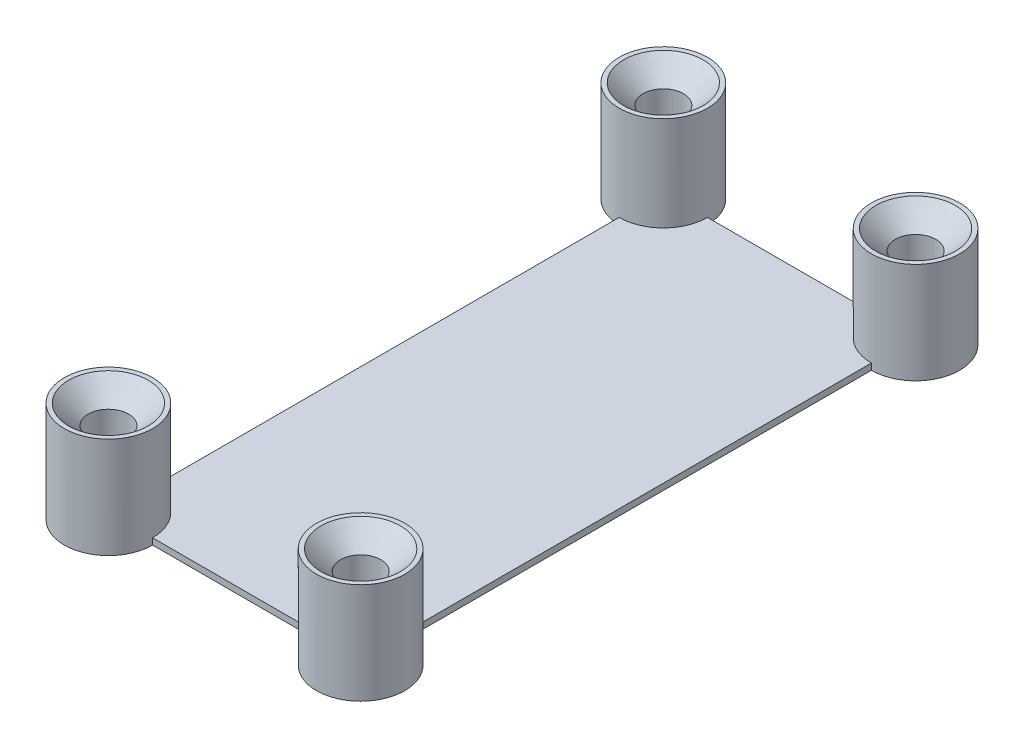
from build123d import *

# Parameters (mm, degrees)
SKETCH2_W                                       = 20
SKETCH2_H                                       = 44
BOSS_EXTRUDE2_DEPTH                             = 0.5
SKETCH4_R                                       = 3.5
BOSS_EXTRUDE3_DEPTH                             = 8
CSK_FOR_M3_FLAT_HEAD_MACHINE_SCREW1_D           = 3.2
CSK_FOR_M3_FLAT_HEAD_MACHINE_SCREW1_DEPTH       = 13.03862301
CSK_FOR_M3_FLAT_HEAD_MACHINE_SCREW1_CSINK_D     = 6.3
CSK_FOR_M3_FLAT_HEAD_MACHINE_SCREW1_CSINK_ANGLE = 90
CSK_FOR_M3_FLAT_HEAD_MACHINE_SCREW1_TIP         = 0.96137699


with BuildPart() as part:
    # Sketch2 → Boss-Extrude2 (new body)
    with BuildSketch(Plane(origin=(0, 0, 0), x_dir=(1, 0, 0), z_dir=(0, 1, 0))):
        with Locations((10, 22)):
            Rectangle(SKETCH2_W, SKETCH2_H)
    extrude(amount=BOSS_EXTRUDE2_DEPTH)

    # Sketch4 → Boss-Extrude3 (add)
    with BuildSketch(Plane(origin=(0, 0, 0), x_dir=(1, 0, 0), z_dir=(0, 1, 0))):
        with Locations(Location((20, 44, 0), (0, 0, 270))):
            Circle(SKETCH4_R)
        with Locations(Location((0, 44, 0), (0, 0, 90))):
            Circle(SKETCH4_R)
        with Locations(Location((20, 0, 0), (0, 0, 90))):
            Circle(SKETCH4_R)
        with Locations(Location((0, 0, 0), (0, 0, 90))):
            Circle(SKETCH4_R)
    extrude(amount=BOSS_EXTRUDE3_DEPTH)

    # CSK for M3 Flat Head Machine Screw1
    with Locations(Plane(origin=(0, 8, 0), x_dir=(1, 0, 0), z_dir=(0, 1, 0))):
        with Locations((20, 44), (0, 44), (0, 0), (20, 0)):
            CounterSinkHole(CSK_FOR_M3_FLAT_HEAD_MACHINE_SCREW1_D / 2, CSK_FOR_M3_FLAT_HEAD_MACHINE_SCREW1_CSINK_D / 2, depth=CSK_FOR_M3_FLAT_HEAD_MACHINE_SCREW1_DEPTH, counter_sink_angle=CSK_FOR_M3_FLAT_HEAD_MACHINE_SCREW1_CSINK_ANGLE)
            with Locations((0, 0, -(CSK_FOR_M3_FLAT_HEAD_MACHINE_SCREW1_DEPTH + CSK_FOR_M3_FLAT_HEAD_MACHINE_SCREW1_TIP / 2))):  # 118° drill point
                Cone(0, CSK_FOR_M3_FLAT_HEAD_MACHINE_SCREW1_D / 2, CSK_FOR_M3_FLAT_HEAD_MACHINE_SCREW1_TIP, mode=Mode.SUBTRACT)


solid = part.part
